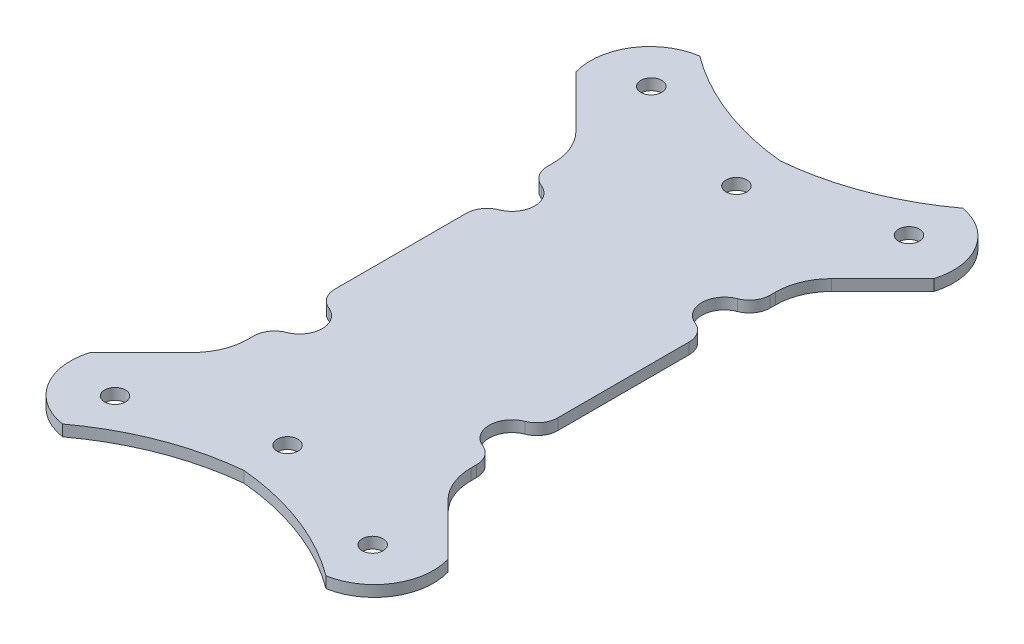
from build123d import *

# Parameters (mm, degrees)
SKETCH1_R           = 1.5
BOSS_EXTRUDE1_DEPTH = 1.6
SKETCH2_R           = 3.25
CUT_EXTRUDE1_DEPTH  = 1.6
FILLET1_R           = 3


with BuildPart() as part:
    # Sketch1 → Boss-Extrude1 (new body)
    with BuildSketch(Plane(origin=(0, 0, 0), x_dir=(1, 0, 0), z_dir=(0, 1, 0))):
        with BuildLine():
            ThreePointArc((168.347792712, 1300.859692621), (159.343486253, 1295.942873675), (149.343647654, 1293.65030495))
            ThreePointArc((149.343647654, 1293.65030495), (139.460555114, 1295.990018463), (130.567766275, 1300.895941835))
            ThreePointArc((130.567766275, 1300.895941835), (124.616810573, 1297.0492589), (123.648598599, 1290.029756856))
            Line((123.648598599, 1290.029756856), (131.000501903, 1282.677853551))
            ThreePointArc((131.000501903, 1282.677853551), (132.734683914, 1280.082466761), (133.343647654, 1277.020999302))
            Line((133.343647654, 1277.020999302), (133.343647654, 1272.65030495))
            Line((133.343647654, 1272.65030495), (133.343647654, 1269.65030495))
            Line((133.343647654, 1269.65030495), (133.343647654, 1240.65030495))
            Line((133.343647654, 1240.65030495), (133.343647654, 1237.65030495))
            Line((133.343647654, 1237.65030495), (133.343647654, 1233.279610599))
            ThreePointArc((133.343647654, 1233.279610599), (132.734683914, 1230.21814314), (131.000501903, 1227.622756349))
            Line((131.000501903, 1227.622756349), (123.648598599, 1220.270853045))
            ThreePointArc((123.648598599, 1220.270853045), (124.616810573, 1213.251351001), (130.567766275, 1209.404668065))
            ThreePointArc((130.567766275, 1209.404668065), (139.460555114, 1214.310591438), (149.343647654, 1216.65030495))
            ThreePointArc((149.343647654, 1216.65030495), (159.343486253, 1214.357736226), (168.347792712, 1209.44091728))
            ThreePointArc((168.347792712, 1209.44091728), (174.131892083, 1213.349250607), (175.038696709, 1220.270853045))
            Line((175.038696709, 1220.270853045), (167.686793404, 1227.622756349))
            ThreePointArc((167.686793404, 1227.622756349), (165.952611394, 1230.21814314), (165.343647654, 1233.279610599))
            Line((165.343647654, 1233.279610599), (165.343647654, 1237.65030495))
            Line((165.343647654, 1237.65030495), (165.343647654, 1240.65030495))
            Line((165.343647654, 1240.65030495), (165.343647654, 1269.65030495))
            Line((165.343647654, 1269.65030495), (165.343647654, 1272.65030495))
            Line((165.343647654, 1272.65030495), (165.343647654, 1277.020999302))
            ThreePointArc((165.343647654, 1277.020999302), (165.952611394, 1280.082466761), (167.686793404, 1282.677853551))
            Line((167.686793404, 1282.677853551), (175.038696709, 1290.029756856))
            ThreePointArc((175.038696709, 1290.029756856), (174.131892083, 1296.951359294), (168.347792712, 1300.859692621))
        make_face()
        with Locations(Location((130.843647654, 1216.65030495, 0), (0, 0, 270))):
            Circle(SKETCH1_R, mode=Mode.SUBTRACT)
        with Locations(Location((149.343647654, 1222.919184261, 0), (0, 0, 270))):
            Circle(SKETCH1_R, mode=Mode.SUBTRACT)
        with Locations(Location((167.843647654, 1216.65030495, 0), (0, 0, 270))):
            Circle(SKETCH1_R, mode=Mode.SUBTRACT)
        with Locations(Location((130.843647654, 1293.65030495, 0), (0, 0, 270))):
            Circle(SKETCH1_R, mode=Mode.SUBTRACT)
        with Locations(Location((149.343647654, 1287.38142564, 0), (0, 0, 270))):
            Circle(SKETCH1_R, mode=Mode.SUBTRACT)
        with BuildLine():
            ThreePointArc((169.343647654, 1293.65030495), (167.843647654, 1292.15030495), (166.343647654, 1293.65030495))
            ThreePointArc((166.343647654, 1293.65030495), (167.843647654, 1295.15030495), (169.343647654, 1293.65030495))
        make_face(mode=Mode.SUBTRACT)
    extrude(amount=BOSS_EXTRUDE1_DEPTH)

    # Sketch2 → Cut-Extrude1 (cut)
    with BuildSketch(Plane(origin=(0, 1.6, 0), x_dir=(1, 0, 0), z_dir=(0, 1, 0))):
        with Locations((134.093647654, 1239.90030495)):
            Circle(SKETCH2_R)
        with Locations((164.593647654, 1239.90030495)):
            Circle(SKETCH2_R)
        with Locations((164.593647654, 1270.40030495)):
            Circle(SKETCH2_R)
        with Locations((134.093647654, 1270.40030495)):
            Circle(SKETCH2_R)
    extrude(amount=-CUT_EXTRUDE1_DEPTH, mode=Mode.SUBTRACT)

    # Fillet1
    fillet1_edges = [part.edges().sort_by_distance(p)[0] for p in [
        (133.343647654, 0.8, -1243.062582611),
        (133.343647654, 0.8, -1236.73802729),
        (133.343647654, 0.8, -1273.562582611),
        (133.343647654, 0.8, -1267.23802729),
        (165.343647654, 0.8, -1267.23802729),
        (165.343647654, 0.8, -1273.562582611),
        (165.343647654, 0.8, -1236.73802729),
        (165.343647654, 0.8, -1243.062582611),
    ]]
    fillet(fillet1_edges, radius=FILLET1_R)


solid = part.part
